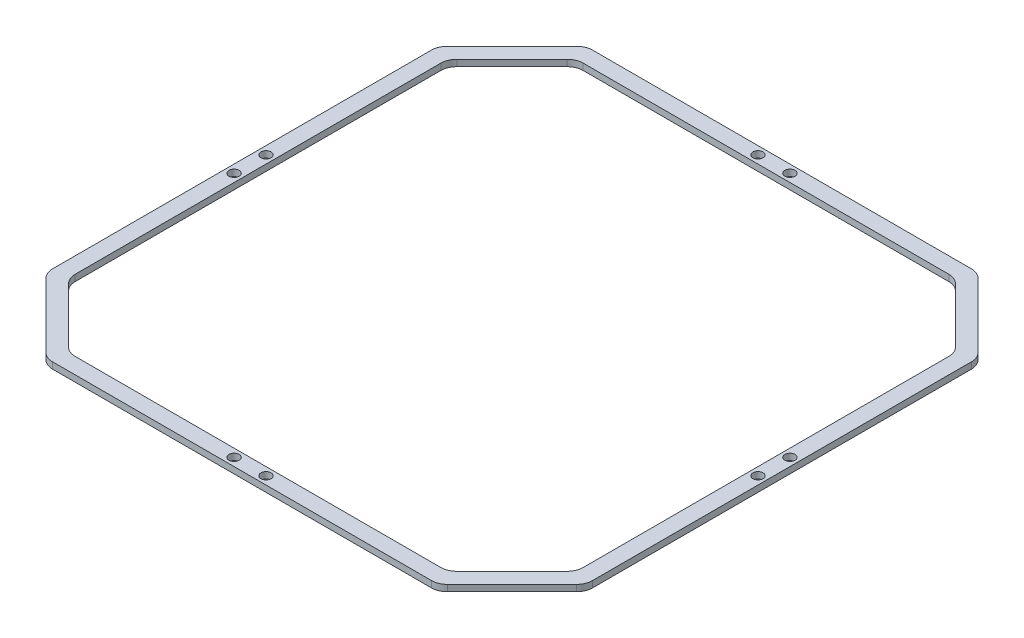
from build123d import *

# Parameters (mm, degrees)
SKETCH_1_R      = 1.6
EXTRUDE_1_DEPTH = 2


with BuildPart() as part:
    # 草图1 → 凸台-拉伸1 (new body)
    with BuildSketch(Plane(origin=(0, 0, 0), x_dir=(1, 0, 0), z_dir=(0, 1, 0))):
        with BuildLine():
            Line((0, 84.5), (59.290367902, 84.5))
            ThreePointArc((59.290367902, 84.5), (61.203785064, 84.119397663), (62.825901808, 83.035533906))
            Line((62.825901808, 83.035533906), (83.035533906, 62.825901808))
            ThreePointArc((83.035533906, 62.825901808), (84.119397663, 61.203785064), (84.5, 59.290367902))
            Line((84.5, 59.290367902), (84.5, 0))
            Line((84.5, 0), (84.5, -59.290367902))
            ThreePointArc((84.5, -59.290367902), (84.119397663, -61.203785064), (83.035533906, -62.825901808))
            Line((83.035533906, -62.825901808), (62.825901808, -83.035533906))
            ThreePointArc((62.825901808, -83.035533906), (61.203785064, -84.119397663), (59.290367902, -84.5))
            Line((59.290367902, -84.5), (0, -84.5))
            Line((0, -84.5), (-59.290367902, -84.5))
            ThreePointArc((-59.290367902, -84.5), (-61.203785064, -84.119397663), (-62.825901808, -83.035533906))
            Line((-62.825901808, -83.035533906), (-83.035533906, -62.825901808))
            ThreePointArc((-83.035533906, -62.825901808), (-84.119397663, -61.203785064), (-84.5, -59.290367902))
            Line((-84.5, -59.290367902), (-84.5, -1.780508218))
            Line((-84.5, -1.780508218), (-84.5, 59.290367902))
            ThreePointArc((-84.5, 59.290367902), (-84.119397663, 61.203785064), (-83.035533906, 62.825901808))
            Line((-83.035533906, 62.825901808), (-62.825901808, 83.035533906))
            ThreePointArc((-62.825901808, 83.035533906), (-61.203785064, 84.119397663), (-59.290367902, 84.5))
            Line((-59.290367902, 84.5), (0, 84.5))
        make_face()
        with Locations(Location((5, 82, 0), (0, 0, 270))):
            Circle(SKETCH_1_R, mode=Mode.SUBTRACT)
        with Locations(Location((-5, 82, 0), (0, 0, 270))):
            Circle(SKETCH_1_R, mode=Mode.SUBTRACT)
        with Locations(Location((82, 5, 0), (0, 0, 270))):
            Circle(SKETCH_1_R, mode=Mode.SUBTRACT)
        with Locations(Location((82, -5, 0), (0, 0, 270))):
            Circle(SKETCH_1_R, mode=Mode.SUBTRACT)
        with Locations(Location((5, -82, 0), (0, 0, 270))):
            Circle(SKETCH_1_R, mode=Mode.SUBTRACT)
        with Locations(Location((-5, -82, 0), (0, 0, 270))):
            Circle(SKETCH_1_R, mode=Mode.SUBTRACT)
        with Locations(Location((-82, -5, 0), (0, 0, 270))):
            Circle(SKETCH_1_R, mode=Mode.SUBTRACT)
        with Locations(Location((-82, 5, 0), (0, 0, 270))):
            Circle(SKETCH_1_R, mode=Mode.SUBTRACT)
        with BuildLine():
            Line((0, 79.5), (57.21930009, 79.5))
            ThreePointArc((57.21930009, 79.5), (59.132717252, 79.119397663), (60.754833996, 78.035533906))
            Line((60.754833996, 78.035533906), (78.035533906, 60.754833996))
            ThreePointArc((78.035533906, 60.754833996), (79.119397663, 59.132717252), (79.5, 57.21930009))
            Line((79.5, 57.21930009), (79.5, 0))
            Line((79.5, 0), (79.5, -57.21930009))
            ThreePointArc((79.5, -57.21930009), (79.119397663, -59.132717252), (78.035533906, -60.754833996))
            Line((78.035533906, -60.754833996), (60.754833996, -78.035533906))
            ThreePointArc((60.754833996, -78.035533906), (59.132717252, -79.119397663), (57.21930009, -79.5))
            Line((57.21930009, -79.5), (0, -79.5))
            Line((0, -79.5), (-57.21930009, -79.5))
            ThreePointArc((-57.21930009, -79.5), (-59.132717252, -79.119397663), (-60.754833996, -78.035533906))
            Line((-60.754833996, -78.035533906), (-78.035533906, -60.754833996))
            ThreePointArc((-78.035533906, -60.754833996), (-79.119397663, -59.132717252), (-79.5, -57.21930009))
            Line((-79.5, -57.21930009), (-79.5, -1.165353087))
            Line((-79.5, -1.165353087), (-79.5, 57.21930009))
            ThreePointArc((-79.5, 57.21930009), (-79.119397663, 59.132717252), (-78.035533906, 60.754833996))
            Line((-78.035533906, 60.754833996), (-60.754833996, 78.035533906))
            ThreePointArc((-60.754833996, 78.035533906), (-59.132717252, 79.119397663), (-57.21930009, 79.5))
            Line((-57.21930009, 79.5), (0, 79.5))
        make_face(mode=Mode.SUBTRACT)
    extrude(amount=EXTRUDE_1_DEPTH)


solid = part.part
